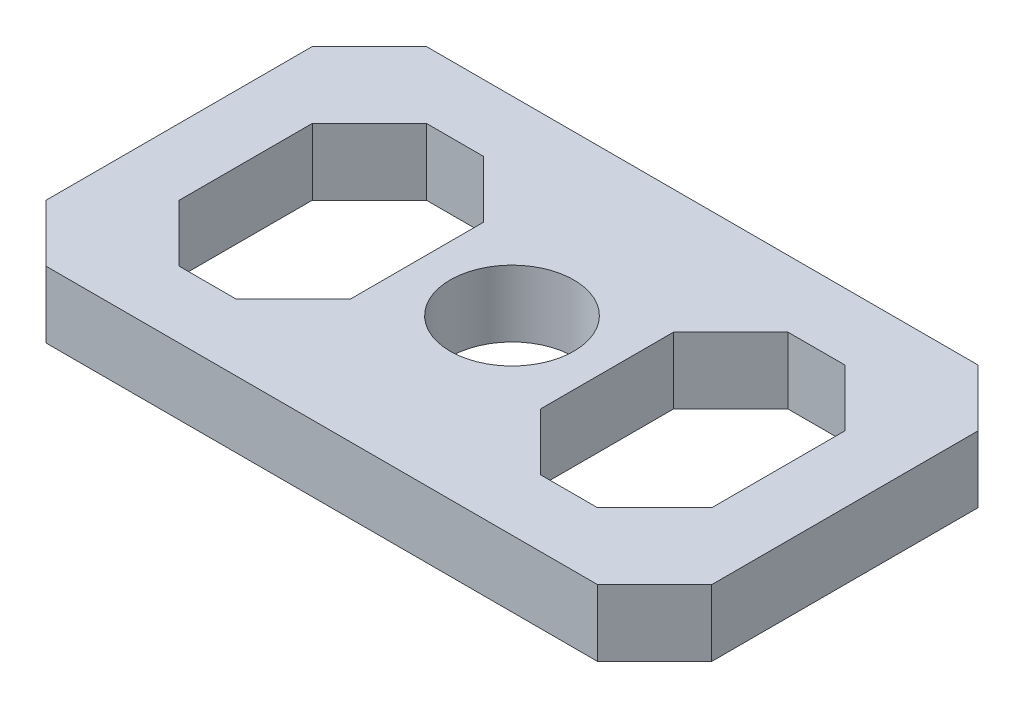
from build123d import *

# Parameters (mm, degrees)
SKETCH1_W           = 70
SKETCH1_H           = 40
SKETCH1_R           = 6.5
SKETCH1_W_2         = 18
SKETCH1_H_2         = 26
BOSS_EXTRUDE1_DEPTH = 7
CHAMFER1_SIZE       = 6


with BuildPart() as part:
    # Sketch1 → Boss-Extrude1 (new body)
    with BuildSketch(Plane(origin=(0, 0, 0), x_dir=(1, 0, 0), z_dir=(0, 1, 0))):
        Rectangle(SKETCH1_W, SKETCH1_H)
        with Locations(Location((0, 0, 0), (0, 0, 270))):
            Circle(SKETCH1_R, mode=Mode.SUBTRACT)
        with Locations((-19, 0)):
            Rectangle(SKETCH1_W_2, SKETCH1_H_2, mode=Mode.SUBTRACT)
        with Locations((19, 0)):
            Rectangle(SKETCH1_W_2, SKETCH1_H_2, mode=Mode.SUBTRACT)
    extrude(amount=BOSS_EXTRUDE1_DEPTH)

    # Chamfer1
    chamfer1_edges = [part.edges().sort_by_distance(p)[0] for p in [
        (-10, 3.5, 13),
        (-10, 3.5, -13),
        (-28, 3.5, -13),
        (-28, 3.5, 13),
        (28, 3.5, 13),
        (28, 3.5, -13),
        (10, 3.5, -13),
        (10, 3.5, 13),
        (35, 3.5, 20),
        (-35, 3.5, 20),
        (-35, 3.5, -20),
        (35, 3.5, -20),
    ]]
    chamfer(chamfer1_edges, length=CHAMFER1_SIZE)


solid = part.part
